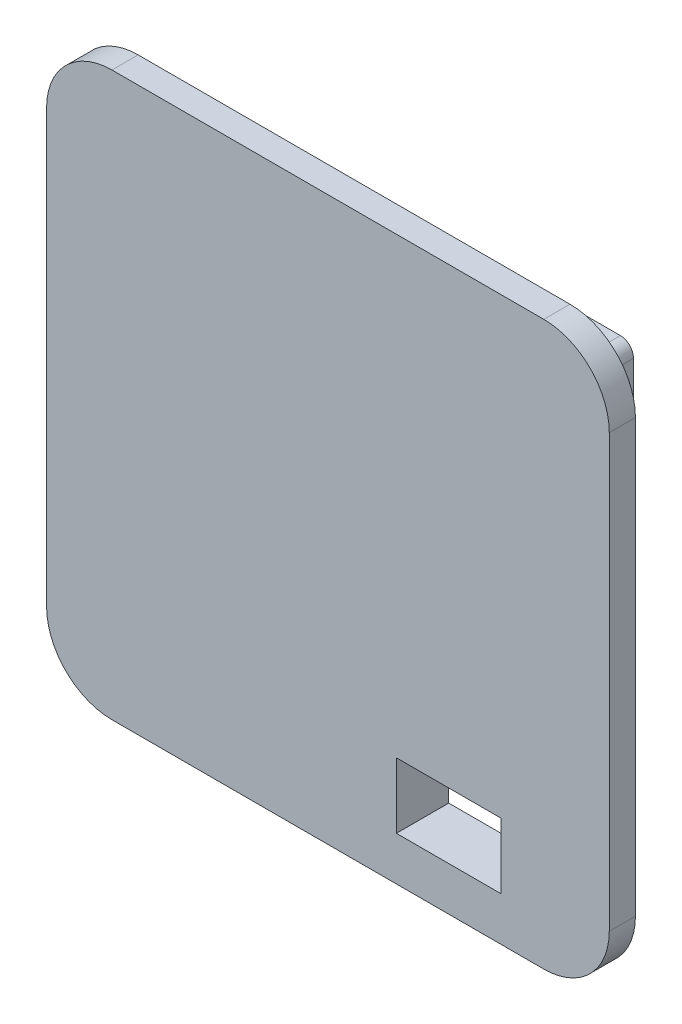
from build123d import *

# Parameters (mm, degrees)
SKETCH1_W           = 43.000000106
SKETCH1_H           = 43
BOSS_EXTRUDE1_DEPTH = 2
FILLET1_R           = 5
SKETCH2_W           = 8
SKETCH2_H           = 5
CUT_EXTRUDE1_DEPTH  = 31.471298008
SKETCH3_W           = 38.7
SKETCH3_H           = 38.7
SKETCH3_W_2         = 5
SKETCH3_H_2         = 8
BOSS_EXTRUDE2_DEPTH = 2
FILLET3_R           = 1


with BuildPart() as part:
    # Sketch1 → Boss-Extrude1 (new body)
    with BuildSketch(Plane(origin=(0, 0, 0), x_dir=(0, 1, 0), z_dir=(0, 0, 1))):
        Rectangle(SKETCH1_W, SKETCH1_H)
    extrude(amount=BOSS_EXTRUDE1_DEPTH)

    # Fillet1
    fillet1_edges = [part.edges().sort_by_distance(p)[0] for p in [
        (-21.5, -21.500000053, 1),
        (-21.5, 21.500000053, 1),
        (21.5, 21.500000053, 1),
        (21.5, -21.500000053, 1),
    ]]
    fillet(fillet1_edges, radius=FILLET1_R)

    # Sketch2 → Cut-Extrude1 (cut, through all)
    with BuildSketch(Plane.XY.offset(2)):
        with Locations((9.232121301, -15.648084214)):
            Rectangle(SKETCH2_W, SKETCH2_H)
    extrude(amount=-CUT_EXTRUDE1_DEPTH, mode=Mode.SUBTRACT)

    # Sketch3 → Boss-Extrude2 (add)
    with BuildSketch(Plane.YX):
        Rectangle(SKETCH3_W, SKETCH3_H)
        with Locations((-15.648084214, 9.232121301)):
            Rectangle(SKETCH3_W_2, SKETCH3_H_2, mode=Mode.SUBTRACT)
    extrude(amount=BOSS_EXTRUDE2_DEPTH)

    # Fillet3
    fillet3_edges = [part.edges().sort_by_distance(p)[0] for p in [
        (-19.35, -19.35, -1),
        (-19.35, 19.35, -1),
        (19.35, 19.35, -1),
        (19.35, -19.35, -1),
    ]]
    fillet(fillet3_edges, radius=FILLET3_R)


solid = part.part
